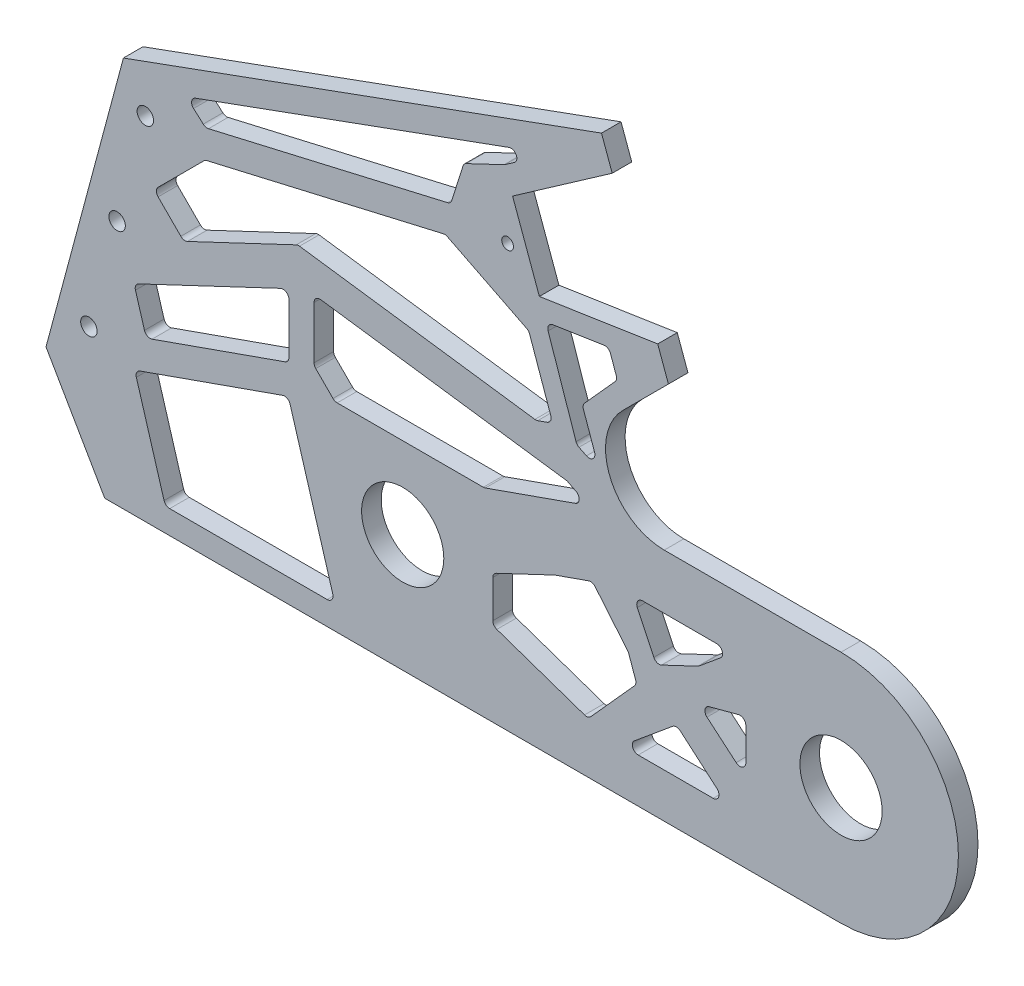
from build123d import *

# Parameters (mm, degrees)
SKETCH1_R           = 10.5
BOSS_EXTRUDE1_DEPTH = 5
FILLET1_R           = 15
SKETCH2_R           = 1.5
CUT_EXTRUDE1_DEPTH  = 5
SKETCH4_R           = 2.1
CUT_EXTRUDE3_DEPTH  = 10
CUT_EXTRUDE4_DEPTH  = 10


with BuildPart() as part:
    # Sketch1 → Boss-Extrude1 (new body)
    with BuildSketch(Plane.XY):
        with BuildLine():
            Line((94.301272012, 107.23010703), (12.917479745, 107.23010703))
            Line((12.917479745, 107.23010703), (50.196394157, 144.509021441))
            Line((50.196394157, 144.509021441), (33.09538699, 191.493652481))
            Line((33.09538699, 191.493652481), (-89.064653712, 147.031033848))
            Line((-89.064653712, 147.031033848), (-108.84470723, 73.210869143))
            Line((-108.84470723, 73.210869143), (-93.84470723, 47.23010703))
            Line((-93.84470723, 47.23010703), (94.301272012, 47.23010703))
            ThreePointArc((94.301272012, 47.23010703), (124.301272012, 77.23010703), (94.301272012, 107.23010703))
        make_face()
        with Locations((-17.698727988, 77.23010703)):
            Circle(SKETCH1_R, mode=Mode.SUBTRACT)
        with Locations((94.301272012, 77.23010703)):
            Circle(SKETCH1_R, mode=Mode.SUBTRACT)
    extrude(amount=BOSS_EXTRUDE1_DEPTH)

    # Fillet1
    fillet1_edges = [part.edges().sort_by_distance(p)[0] for p in [
        (12.917479745, 107.23010703, 2.5),
    ]]
    fillet(fillet1_edges, radius=FILLET1_R)

    # Sketch2 → Cut-Extrude1 (cut)
    with BuildSketch(Plane.XY.offset(5)):
        with Locations((9.098668989, 155.090939324)):
            Circle(SKETCH2_R)
        Polygon((35.831548137, 183.976111514), (10.37693066, 166.197966248), (17.217333526, 147.404113833), (47.46023301, 152.026562408), align=None)
    extrude(amount=-CUT_EXTRUDE1_DEPTH, mode=Mode.SUBTRACT)

    # Sketch4 → Cut-Extrude3 (cut)
    with BuildSketch(Plane.XY.offset(5)):
        with Locations((-83.461936193, 137.031033848)):
            Circle(SKETCH4_R)
        with Locations((-90.672471028, 110.120951496)):
            Circle(SKETCH4_R)
        with Locations((-97.883005862, 83.210869143)):
            Circle(SKETCH4_R)
    extrude(amount=-CUT_EXTRUDE3_DEPTH, mode=Mode.SUBTRACT)

    # Sketch5 → Cut-Extrude4 (cut)
    with BuildSketch(Plane.XY.offset(5)):
        with BuildLine():
            Line((-48.918590023, 116.132580639), (-85.191500994, 98.984877604))
            ThreePointArc((-85.191500994, 98.984877604), (-85.920322831, 98.239804651), (-85.987744542, 97.199723264))
            Line((-85.987744542, 97.199723264), (-83.678802495, 89.464767405))
            ThreePointArc((-83.678802495, 89.464767405), (-82.922106683, 88.557131084), (-81.742997435, 88.479069431))
            Line((-81.742997435, 88.479069431), (-47.779028512, 100.446008168))
            ThreePointArc((-47.779028512, 100.446008168), (-47.053226731, 100.994074602), (-46.777505051, 101.860759433))
            Line((-46.777505051, 101.860759433), (-46.777505051, 114.776479588))
            ThreePointArc((-46.777505051, 114.776479588), (-47.474892896, 116.043686646), (-48.918590023, 116.132580639))
        make_face()
        with BuildLine():
            Line((-40.354065156, 117.285126681), (-40.354065156, 103.938271148))
            ThreePointArc((-40.354065156, 103.938271148), (-40.239884455, 103.364246), (-39.914725328, 102.877610977))
            Line((-39.914725328, 102.877610977), (-35.506024812, 98.468910461))
            ThreePointArc((-35.506024812, 98.468910461), (-35.019389788, 98.143751334), (-34.44536464, 98.029570632))
            Line((-34.44536464, 98.029570632), (2.900545466, 98.029570632))
            ThreePointArc((2.900545466, 98.029570632), (3.153402247, 98.05103641), (3.399022006, 98.114819368))
            Line((3.399022006, 98.114819368), (26.404973303, 106.220786324))
            ThreePointArc((26.404973303, 106.220786324), (27.403506638, 107.540872748), (26.579216219, 108.976227162))
            Line((26.579216219, 108.976227162), (24.498135227, 110.020453731))
            ThreePointArc((24.498135227, 110.020453731), (24.269772253, 110.112435549), (24.029439243, 110.16582419))
            Line((24.029439243, 110.16582419), (-38.650041684, 118.771186715))
            ThreePointArc((-38.650041684, 118.771186715), (-39.839956832, 118.415621088), (-40.354065156, 117.285126681))
        make_face()
        with BuildLine():
            Line((-74.392110194, 114.92256466), (-80.203002255, 120.733456721))
            ThreePointArc((-80.203002255, 120.733456721), (-80.642342083, 121.794116893), (-80.203002255, 122.854777065))
            Line((-80.203002255, 122.854777065), (-68.473782604, 134.583996716))
            ThreePointArc((-68.473782604, 134.583996716), (-68.141065775, 134.834861797), (-67.752173145, 134.98451573))
            Line((-67.752173145, 134.98451573), (-7.313265805, 149.008705779))
            ThreePointArc((-7.313265805, 149.008705779), (-6.796836559, 149.037001955), (-6.301495636, 148.888216166))
            Line((-6.301495636, 148.888216166), (13.97461757, 138.714245904))
            ThreePointArc((13.97461757, 138.714245904), (14.427382099, 138.365164015), (14.716649378, 137.87203287))
            Line((14.716649378, 137.87203287), (20.14067974, 122.477820308))
            ThreePointArc((20.14067974, 122.477820308), (20.07878483, 121.331439698), (19.224405015, 120.564592504))
            Line((19.224405015, 120.564592504), (16.778026718, 119.70263025))
            ThreePointArc((16.778026718, 119.70263025), (16.431032479, 119.625050079), (16.075526706, 119.631321481))
            Line((16.075526706, 119.631321481), (-44.068033081, 127.888523484))
            ThreePointArc((-44.068033081, 127.888523484), (-44.500043445, 127.885036207), (-44.913141524, 127.758564501))
            Line((-44.913141524, 127.758564501), (-72.690365051, 114.627123781))
            ThreePointArc((-72.690365051, 114.627123781), (-73.588027819, 114.505331793), (-74.392110194, 114.92256466))
        make_face()
        with BuildLine():
            Line((-85.765173696, 78.039759187), (-78.678992966, 54.30105374))
            ThreePointArc((-78.678992966, 54.30105374), (-78.137884303, 53.527281204), (-77.241664446, 53.23010703))
            Line((-77.241664446, 53.23010703), (-37.000229644, 53.23010703))
            ThreePointArc((-37.000229644, 53.23010703), (-35.797403818, 53.833887172), (-35.562901123, 55.159160319))
            Line((-35.562901123, 55.159160319), (-46.478753465, 91.727265664))
            ThreePointArc((-46.478753465, 91.727265664), (-47.235449276, 92.634901985), (-48.414558525, 92.712963639))
            Line((-48.414558525, 92.712963639), (-84.826321716, 79.88356374))
            ThreePointArc((-84.826321716, 79.88356374), (-85.664534787, 79.149445185), (-85.765173696, 78.039759187))
        make_face()
        with BuildLine():
            Line((-71.137681218, 144.818765729), (-68.657481405, 142.605973483))
            ThreePointArc((-68.657481405, 142.605973483), (-68.030328991, 142.271974344), (-67.319826927, 142.264075548))
            Line((-67.319826927, 142.264075548), (-6.252231197, 156.434145889))
            ThreePointArc((-6.252231197, 156.434145889), (-5.572632004, 156.794256335), (-5.160840216, 157.443842448))
            Line((-5.160840216, 157.443842448), (-2.289133326, 166.54233045))
            ThreePointArc((-2.289133326, 166.54233045), (-1.989907511, 167.075911596), (-1.502525339, 167.445646022))
            Line((-1.502525339, 167.445646022), (8.200620604, 172.056821639))
            ThreePointArc((8.200620604, 172.056821639), (8.310747045, 172.114876187), (8.415680154, 172.181862799))
            Line((8.415680154, 172.181862799), (10.823804629, 173.863757519))
            ThreePointArc((10.823804629, 173.863757519), (11.295841918, 175.785341043), (9.451881159, 176.503053489))
            Line((9.451881159, 176.503053489), (-70.652107667, 147.347585911))
            ThreePointArc((-70.652107667, 147.347585911), (-71.612166791, 146.220903478), (-71.137681218, 144.818765729))
        make_face()
        with BuildLine():
            Line((19.452688101, 140.902959313), (26.597478805, 119.959650962))
            ThreePointArc((26.597478805, 119.959650962), (26.886716152, 119.457994505), (27.344420536, 119.103277518))
            Line((27.344420536, 119.103277518), (29.242952451, 118.150648824))
            ThreePointArc((29.242952451, 118.150648824), (30.907279592, 118.365854413), (31.330423172, 119.989814938))
            Line((31.330423172, 119.989814938), (28.480406053, 128.078591439))
            ThreePointArc((28.480406053, 128.078591439), (28.42405424, 128.870079474), (28.779368612, 129.579572626))
            Line((28.779368612, 129.579572626), (36.555739431, 138.234681359))
            ThreePointArc((36.555739431, 138.234681359), (36.911053804, 138.944174511), (36.854701991, 139.735662546))
            Line((36.854701991, 139.735662546), (35.391422248, 143.888670161))
            ThreePointArc((35.391422248, 143.888670161), (34.74811051, 144.676615426), (33.750036797, 144.872973762))
            Line((33.750036797, 144.872973762), (20.645715101, 142.870055583))
            ThreePointArc((20.645715101, 142.870055583), (19.589797516, 142.165132082), (19.452688101, 140.902959313))
        make_face()
        with BuildLine():
            Line((29.815786136, 90.775099636), (21.291462651, 87.771620945))
            ThreePointArc((21.291462651, 87.771620945), (21.219404291, 87.744129544), (21.148854219, 87.712970731))
            Line((21.148854219, 87.712970731), (6.195871701, 80.644078358))
            ThreePointArc((6.195871701, 80.644078358), (5.569749615, 80.090589463), (5.336956673, 79.287977308))
            Line((5.336956673, 79.287977308), (5.336956673, 69.717357349))
            ThreePointArc((5.336956673, 69.717357349), (5.615715461, 68.846398164), (6.348383209, 68.299155681))
            Line((6.348383209, 68.299155681), (28.762867567, 60.577318579))
            ThreePointArc((28.762867567, 60.577318579), (29.627673329, 60.543470228), (30.367229735, 60.9930156))
            Line((30.367229735, 60.9930156), (41.497463613, 73.380977374))
            ThreePointArc((41.497463613, 73.380977374), (41.852777986, 74.090470526), (41.796426172, 74.88195856))
            Line((41.796426172, 74.88195856), (40.058915507, 79.813274708))
            ThreePointArc((40.058915507, 79.813274708), (39.949210994, 80.054293252), (39.798832512, 80.272264193))
            Line((39.798832512, 80.272264193), (31.468930944, 90.317814397))
            ThreePointArc((31.468930944, 90.317814397), (30.714168094, 90.806057767), (29.815786136, 90.775099636))
        make_face()
        with BuildLine():
            Line((42.24427744, 91.095227742), (46.46113264, 82.175221783))
            ThreePointArc((46.46113264, 82.175221783), (47.311640972, 81.404082975), (48.458318662, 81.460205704))
            Line((48.458318662, 81.460205704), (57.693632468, 85.826119946))
            ThreePointArc((57.693632468, 85.826119946), (57.85814362, 85.916908827), (58.010013522, 86.027552727))
            Line((58.010013522, 86.027552727), (63.502078057, 90.581644445))
            ThreePointArc((63.502078057, 90.581644445), (63.955640452, 92.245231959), (62.544612032, 93.236312714))
            Line((62.544612032, 93.236312714), (43.60037849, 93.236312714))
            ThreePointArc((43.60037849, 93.236312714), (42.333171432, 92.538924869), (42.24427744, 91.095227742))
        make_face()
        with BuildLine():
            Line((51.268567993, 69.307256916), (41.511994194, 61.21697836))
            ThreePointArc((41.511994194, 61.21697836), (41.058431799, 59.553390846), (42.469460219, 58.562310092))
            Line((42.469460219, 58.562310092), (61.622416924, 58.562310092))
            ThreePointArc((61.622416924, 58.562310092), (63.028666211, 59.540330264), (62.601128605, 61.19902617))
            Line((62.601128605, 61.19902617), (53.2047457, 69.289304726))
            ThreePointArc((53.2047457, 69.289304726), (52.239941382, 69.652524174), (51.268567993, 69.307256916))
        make_face()
        with BuildLine():
            Line((67.498580228, 69.401810839), (60.046591123, 75.731258856))
            ThreePointArc((60.046591123, 75.731258856), (59.554291768, 77.204084461), (60.630425962, 78.323686674))
            Line((60.630425962, 78.323686674), (68.082415068, 80.314857078))
            ThreePointArc((68.082415068, 80.314857078), (69.383188538, 80.055407885), (69.969630372, 78.865697215))
            Line((69.969630372, 78.865697215), (69.969630372, 70.545078794))
            ThreePointArc((69.969630372, 70.545078794), (69.099481459, 69.183723731), (67.498580228, 69.401810839))
        make_face()
    extrude(amount=-CUT_EXTRUDE4_DEPTH, mode=Mode.SUBTRACT)


solid = part.part
